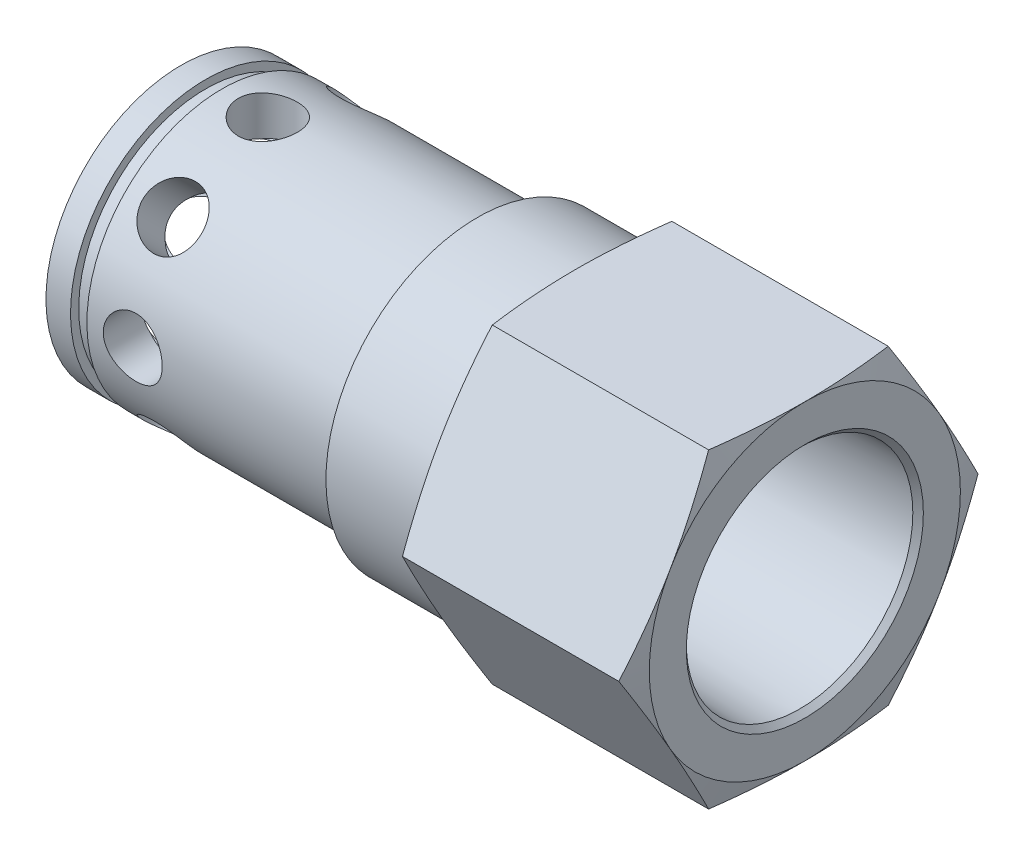
from build123d import *

# Parameters (mm, degrees)
SKETCH1_R           = 3
BOSS_EXTRUDE1_DEPTH = 38.1
FILLET1_R           = 0.2
CIRPATTERN1_COUNT   = 8


with BuildPart() as part:
    # Sketch1 → Boss-Extrude1 (new body)
    with BuildSketch(Plane(origin=(0, 0, 0), x_dir=(0, 0, -1), z_dir=(1, 0, 0))):
        Polygon((10.969655115, 0), (5.484827557, 9.5), (-5.484827557, 9.5), (-10.969655115, 0), (-5.484827557, -9.5), (5.484827557, -9.5), align=None)
        with Locations(Location((0, 0, 0), (0, 0, 180))):
            Circle(SKETCH1_R, mode=Mode.SUBTRACT)
    extrude(amount=BOSS_EXTRUDE1_DEPTH)

    # Sketch2 → Cut-Revolve1 (revolve, cut)
    with BuildSketch(Plane.XY, mode=Mode.PRIVATE) as cut_revolve1_sk:
        Polygon((24.1, 9.5), (24.1, 9.25), (18.1, 9.25), (18.1, 8.25), (2.5, 8.25), (2.5, 7.75), (1.5, 7.75), (1.5, 8.25), (0, 8.25), (0, 13), (25.037822174, 13), align=None)
        Polygon((38.1, 9.5), (38.1, 13), (37.162177826, 13), align=None)
    revolve(cut_revolve1_sk.sketch.rotate(Axis((0, 0, 0), (1, 0, 0)), 180), axis=Axis((0, 0, 0), (1, 0, 0)), mode=Mode.SUBTRACT)

    # Sketch3 → Cut-Revolve2 (revolve, cut)
    with BuildSketch(Plane.XY, mode=Mode.PRIVATE) as cut_revolve2_sk:
        Polygon((0, 5.85), (9.9, 5.85), (10.95, 4.8), (13, 4.8), (13, 6.25), (15.5, 6.25), (15.5, 4.8), (21.4, 4.8), (21.4, 0), (0, 0), align=None)
    revolve(cut_revolve2_sk.sketch.rotate(Axis((0, 0, 0), (1, 0, 0)), 90), axis=Axis((0, 0, 0), (1, 0, 0)), mode=Mode.SUBTRACT)

    # Fillet1
    fillet1_edges = [part.edges().sort_by_distance(p)[0] for p in [
        (13, 0, -6.25),
        (15.5, 0, -6.25),
    ]]
    fillet(fillet1_edges, radius=FILLET1_R)

    # Sketch4 → 1/4 NPT Tapped Hole1 (revolve, cut)
    with BuildSketch(Plane(origin=(38.1, 0, 0), x_dir=(0, 0, -1), z_dir=(0, 1, 0))):
        Polygon((0, 0), (0, 14.2), (5.5626, 14.2), (5.5626, 12), (6.56760783, 12), (6.9172709, 0.3217291), (7.239, 0), align=None)
    revolve(axis=Axis((44.45, 0, 0), (-1, 0, 0)), mode=Mode.SUBTRACT)

    # Sketch12 → Cut-Revolve3 (revolve, cut)
    with BuildSketch(Plane(origin=(0, 0, 0), x_dir=(1, 0, 0), z_dir=(0, 1, 0)), mode=Mode.PRIVATE) as cut_revolve3_sk:
        Polygon((5.3, 8.25), (5.3, 5.629827876), (6.9, 5.629827876), (7.1, 5.75), (7.1, 8.25), align=None)
    cut_revolve3 = revolve(cut_revolve3_sk.sketch.rotate(Axis((5.3, 0, -8.25), (0, 0, 1)), 180), axis=Axis((5.3, 0, -8.25), (0, 0, 1)), mode=Mode.SUBTRACT)

    # CirPattern1: Cut-Revolve3 ×8 about axis
    cirpattern1_axis = Axis((0, 0, 0), (1, 0, 0))
    for i in range(1, CIRPATTERN1_COUNT):
        add(cut_revolve3.rotate(cirpattern1_axis, i * 360 / CIRPATTERN1_COUNT), mode=Mode.SUBTRACT)


solid = part.part
